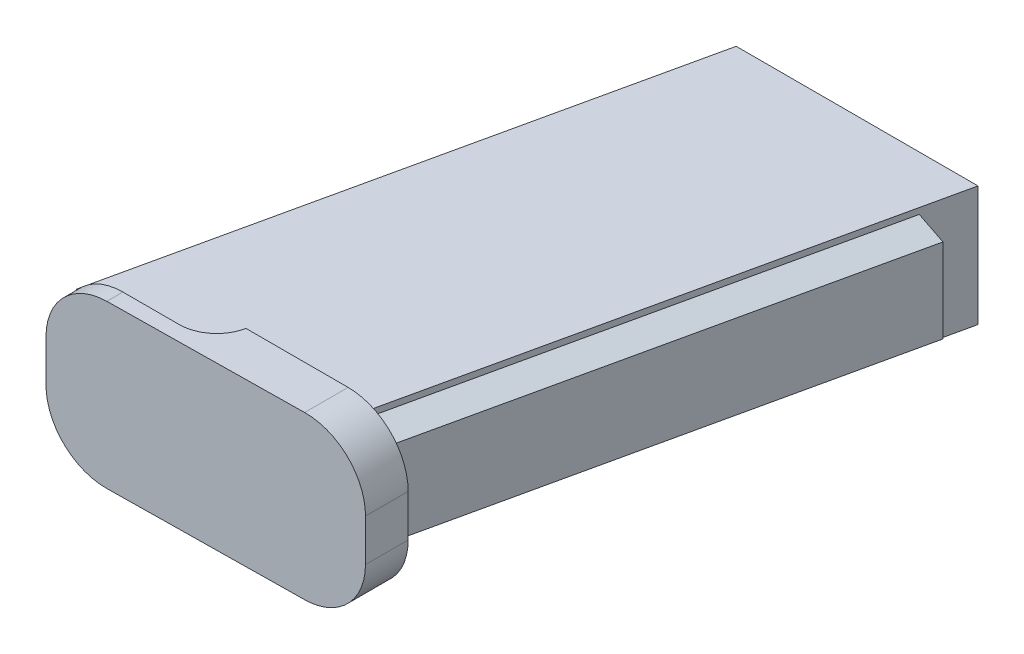
from build123d import *

# Parameters (mm, degrees)
EXTRUDE_1_DEPTH          = 10
EXTRUDE_1_DEPTH_BACK     = 10
EXTRUDE_2_DEPTH          = 10
EXTRUDE_2_DEPTH_BACK     = 10
CUT_EXTRUDE_1_DEPTH      = 78.86350451
CUT_EXTRUDE_2_DEPTH      = 331.104586341
CUT_EXTRUDE_2_DEPTH_BACK = 331.104586341
SKETCH_7_W               = 31.119179355
SKETCH_7_H               = 7.69001946
EXTRUDE_3_DEPTH          = 15
CUT_EXTRUDE_3_DEPTH      = 331.22914457
CUT_EXTRUDE_3_DEPTH_BACK = 331.22914457
CUT_EXTRUDE_4_DEPTH      = 3.5
CUT_EXTRUDE_5_DEPTH      = 5.121010883


with BuildPart() as part:
    # 草图3 → 凸台-拉伸1 (new, two sides: drawn at the far end of the back side and taken through both)
    with BuildSketch(Plane(origin=(0, 0, 0), x_dir=(1, 0, 0), z_dir=(0, 1, 0)).offset(-EXTRUDE_1_DEPTH_BACK)):
        Polygon((213.340896476, 89.860350871), (216.879610096, 89.860350871), (218.224577979, 95.937014496), (254.949012169, 95.937014496), (273.762340852, 180.937014496), (233.499193043, 180.937014496), align=None)
    extrude(amount=EXTRUDE_1_DEPTH + EXTRUDE_1_DEPTH_BACK)

    # 草图5 → 凸台-拉伸2 (add, two sides: drawn at the far end of the back side and taken through both)
    with BuildSketch(Plane(origin=(0, 0, 0), x_dir=(1, 0, 0), z_dir=(0, 1, 0)).offset(-EXTRUDE_2_DEPTH_BACK)):
        Polygon((271.991674623, 172.937014496), (275.918166689, 172.937014496), (258.875504234, 95.937014496), (254.949012169, 95.937014496), align=None)
    extrude(amount=EXTRUDE_2_DEPTH + EXTRUDE_2_DEPTH_BACK)

    # 草图6 → 切除-拉伸1 (cut, along a direction that is not the sketch's normal)
    with BuildSketch(Plane(origin=(0, 0, -172.937014496), x_dir=(-1, 0, 0), z_dir=(0, 0, -1))):
        Polygon((-275.918166689, 7), (-271.991674623, 9), (-271.991674623, 10), (-275.918166689, 10), align=None)
        Polygon((-271.991674623, -9), (-271.991674623, -10), (-275.918166689, -10), (-275.918166689, -7), align=None)
    extrude(amount=-CUT_EXTRUDE_1_DEPTH, dir=(0.21610328580589588, 0, -0.9763705084976171), mode=Mode.SUBTRACT)

    # 草图7 → 切除-拉伸2 (cut, two sides: drawn at the far end of the back side and taken through both)
    with BuildSketch(Plane(origin=(0, 0, 0), x_dir=(1, 0, 0), z_dir=(0, 1, 0)).offset(-CUT_EXTRUDE_2_DEPTH_BACK)):
        with Locations((213.489275448, 87.122004766)):
            Rectangle(SKETCH_7_W, SKETCH_7_H)
    extrude(amount=CUT_EXTRUDE_2_DEPTH + CUT_EXTRUDE_2_DEPTH_BACK, mode=Mode.SUBTRACT)

    # 草图8 → 凸台-拉伸3 (add)
    with BuildSketch(Plane.XY.offset(-95.937014496)):
        with BuildLine():
            Line((253.875504234, 13.5), (221.375504234, 13.5))
            ThreePointArc((221.375504234, 13.5), (214.304436422, 10.571067812), (211.375504234, 3.5))
            Line((211.375504234, 3.5), (211.375504234, -3.5))
            ThreePointArc((211.375504234, -3.5), (214.304436422, -10.571067812), (221.375504234, -13.5))
            Line((221.375504234, -13.5), (253.875504234, -13.5))
            ThreePointArc((253.875504234, -13.5), (260.946572046, -10.571067812), (263.875504234, -3.5))
            Line((263.875504234, -3.5), (263.875504234, 3.5))
            ThreePointArc((263.875504234, 3.5), (260.946572046, 10.571067812), (253.875504234, 13.5))
        make_face()
    extrude(amount=EXTRUDE_3_DEPTH)

    # 草图11 → 切除-拉伸3 (cut, two sides: drawn at the far end of the back side and taken through both)
    with BuildSketch(Plane(origin=(0, 0, 0), x_dir=(1, 0, 0), z_dir=(0, 1, 0)).offset(-CUT_EXTRUDE_3_DEPTH_BACK)):
        Polygon((268.062661222, 88.884668272), (201.658116102, 88.000919674), (201.658116102, 68.770636621), (268.062661222, 68.770636621), align=None)
    extrude(amount=CUT_EXTRUDE_3_DEPTH + CUT_EXTRUDE_3_DEPTH_BACK, mode=Mode.SUBTRACT)

    # 草图13 → 切除-拉伸4 (cut)
    with BuildSketch(Plane(origin=(0, 13.5, 0), x_dir=(1, 0, 0), z_dir=(0, 1, 0))):
        with BuildLine():
            Line((208, 90.937014496), (230.757405295, 90.937014496))
            ThreePointArc((230.757405295, 90.937014496), (234.708074056, 92.346011488), (236.875504234, 95.937014496))
            Line((236.875504234, 95.937014496), (236.875504234, 103.30474676))
            Line((236.875504234, 103.30474676), (208, 103.30474676))
            Line((208, 103.30474676), (208, 90.937014496))
        make_face()
    cut_extrude_4 = extrude(amount=-CUT_EXTRUDE_4_DEPTH, mode=Mode.SUBTRACT)

    # 镜向1: 切除-拉伸4 across plane
    add(cut_extrude_4.mirror(Plane.ZX), mode=Mode.SUBTRACT)

    # 草图14 → 切除-拉伸5 (cut, along a direction that is not the sketch's normal)
    with BuildSketch(Plane(origin=(0, 0, -95.937014496), x_dir=(-1, 0, 0), z_dir=(0, 0, -1))):
        with BuildLine():
            Line((-213.776162157, -10), (-214.68586436, -10))
            Line((-214.68586436, -10), (-214.68586436, 10))
            Line((-214.68586436, 10), (-213.776162157, 10))
            ThreePointArc((-213.776162157, 10), (-211.994848053, 6.964576398), (-211.375504234, 3.5))
            Line((-211.375504234, 3.5), (-211.375504234, -3.5))
            ThreePointArc((-211.375504234, -3.5), (-211.994848053, -6.964576398), (-213.776162157, -10))
        make_face()
    extrude(amount=-CUT_EXTRUDE_5_DEPTH, dir=(0.2161032858058959, 0, -0.9763705084976171), mode=Mode.SUBTRACT)


solid = part.part
